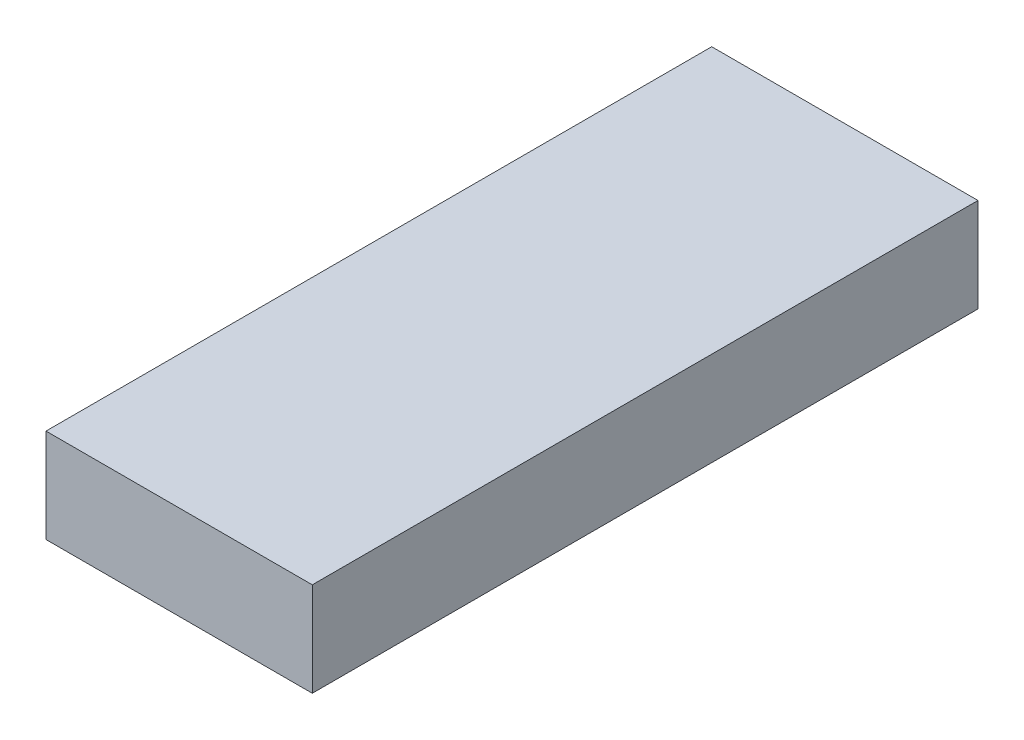
from build123d import *

# Parameters (mm, degrees)
SKETCH1_W           = 18.000000068
SKETCH1_H           = 44.999999916
BOSS_EXTRUDE1_DEPTH = 6.35


with BuildPart() as part:
    # Sketch1 → Boss-Extrude1 (new body)
    with BuildSketch(Plane(origin=(0, 0, 0), x_dir=(1, 0, 0), z_dir=(0, 1, 0))):
        Rectangle(SKETCH1_W, SKETCH1_H)
    extrude(amount=BOSS_EXTRUDE1_DEPTH)


solid = part.part
